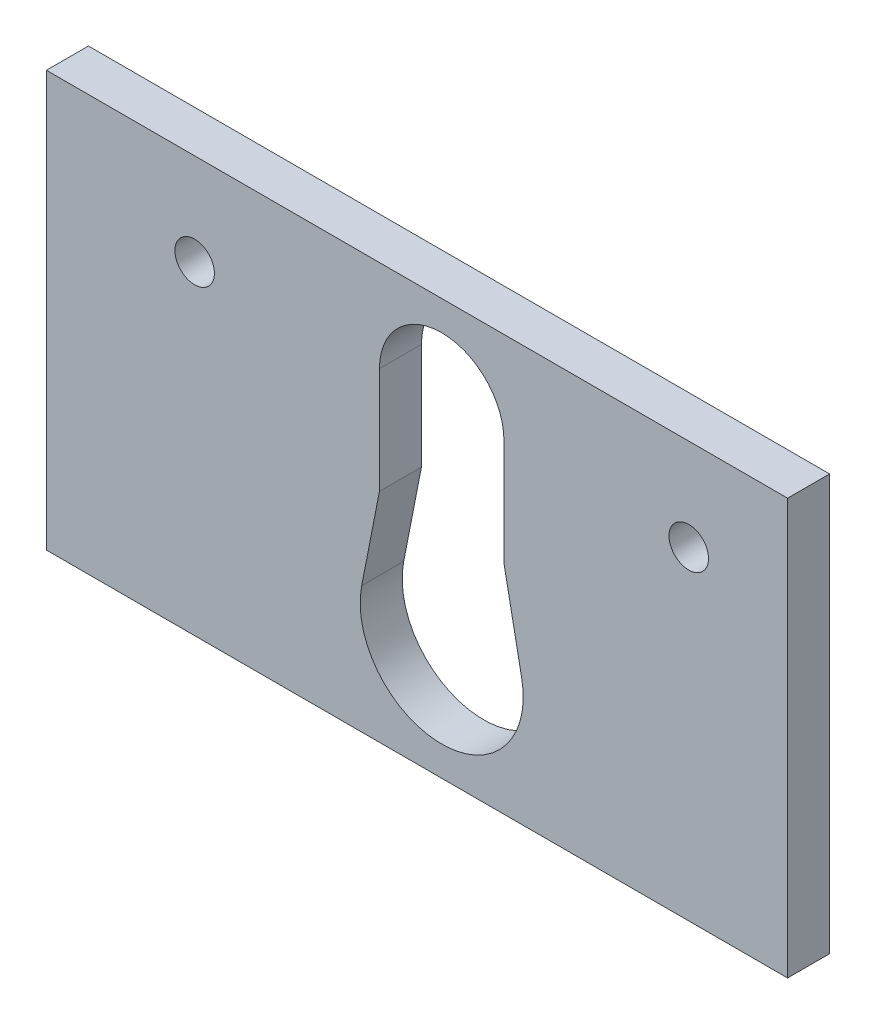
from build123d import *

# Parameters (mm, degrees)
SKETCH1_W           = 75
SKETCH1_H           = 42.05
SKETCH1_R           = 2
BOSS_EXTRUDE2_DEPTH = 4.25


with BuildPart() as part:
    # Sketch1 → Boss-Extrude2 (new body)
    with BuildSketch(Plane.XY):
        with Locations((-2.5, -11.725)):
            Rectangle(SKETCH1_W, SKETCH1_H)
        with Locations((-25, 0)):
            Circle(SKETCH1_R, mode=Mode.SUBTRACT)
        with Locations((25, 0)):
            Circle(SKETCH1_R, mode=Mode.SUBTRACT)
        with BuildLine():
            ThreePointArc((-8.09596287, -19.913215449), (0, -29.75), (8.09596287, -19.913215449))
            Line((8.09596287, -19.913215449), (6.3, -10.75))
            Line((6.3, -10.75), (6.3, 0))
            ThreePointArc((6.3, 0), (0, 6.3), (-6.3, 0))
            Line((-6.3, 0), (-6.3, -10.75))
            Line((-6.3, -10.75), (-8.09596287, -19.913215449))
        make_face(mode=Mode.SUBTRACT)
    extrude(amount=BOSS_EXTRUDE2_DEPTH)


solid = part.part
